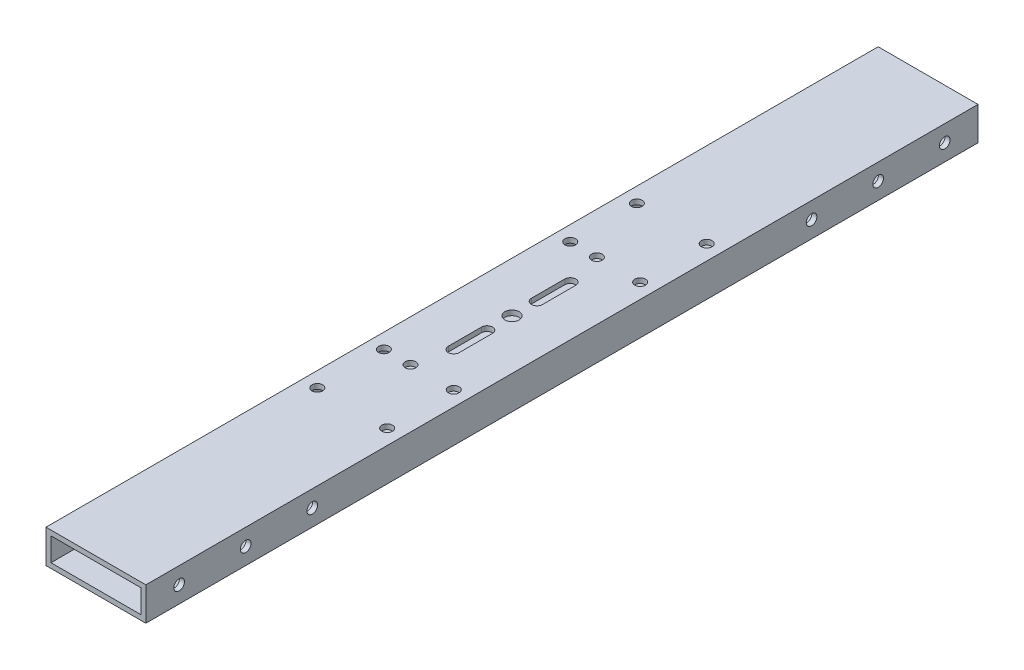
from build123d import *

# Parameters (mm, degrees)
SKETCH_1_W          = 30
SKETCH_1_H          = 10
SKETCH_1_W_2        = 27
SKETCH_1_H_2        = 7
EXTRUDE_1_DEPTH     = 250
SKETCH_2_R          = 1.6
CUT_EXTRUDE_1_DEPTH = 252.843205189
SKETCH_3_R          = 1.6
CUT_EXTRUDE_2_DEPTH = 251.64915719
SKETCH_4_R          = 2.15
CUT_EXTRUDE_3_DEPTH = 251.64915719


with BuildPart() as part:
    # 草图1 → 凸台-拉伸1 (new body)
    with BuildSketch(Plane.XY):
        Rectangle(SKETCH_1_W, SKETCH_1_H)
        Rectangle(SKETCH_1_W_2, SKETCH_1_H_2, mode=Mode.SUBTRACT)
    extrude(amount=EXTRUDE_1_DEPTH)

    # 草图2 → 切除-拉伸1 (cut, through all)
    with BuildSketch(Plane(origin=(15, 0, 0), x_dir=(0, 0, -1), z_dir=(1, 0, 0))):
        with Locations((-240, 0)):
            Circle(SKETCH_2_R)
        with Locations((-220, 0)):
            Circle(SKETCH_2_R)
        with Locations((-200, 0)):
            Circle(SKETCH_2_R)
        with Locations((-50, 0)):
            Circle(SKETCH_2_R)
        with Locations((-30, 0)):
            Circle(SKETCH_2_R)
        with Locations((-10, 0)):
            Circle(SKETCH_2_R)
    extrude(amount=-CUT_EXTRUDE_1_DEPTH, mode=Mode.SUBTRACT)

    # 草图3 → 切除-拉伸2 (cut, through all)
    with BuildSketch(Plane(origin=(0, 5, 0), x_dir=(1, 0, 0), z_dir=(0, 1, 0))):
        with Locations(Location((-2.5, -97, 0), (0, 0, 270))):
            Circle(SKETCH_3_R)
        with Locations(Location((10.5, -97, 0), (0, 0, 270))):
            Circle(SKETCH_3_R)
        with Locations(Location((-2.5, -153, 0), (0, 0, 270))):
            Circle(SKETCH_3_R)
        with Locations(Location((10.5, -153, 0), (0, 0, 270))):
            Circle(SKETCH_3_R)
        with Locations(Location((10.5, -173, 0), (0, 0, 270))):
            Circle(SKETCH_3_R)
        with Locations(Location((10.5, -77, 0), (0, 0, 270))):
            Circle(SKETCH_3_R)
        with Locations(Location((-10.5, -173, 0), (0, 0, 270))):
            Circle(SKETCH_3_R)
        with Locations(Location((-10.5, -153, 0), (0, 0, 270))):
            Circle(SKETCH_3_R)
        with Locations(Location((-10.5, -77, 0), (0, 0, 270))):
            Circle(SKETCH_3_R)
        with Locations(Location((-10.5, -97, 0), (0, 0, 270))):
            Circle(SKETCH_3_R)
    extrude(amount=-CUT_EXTRUDE_2_DEPTH, mode=Mode.SUBTRACT)

    # 草图4 → 切除-拉伸3 (cut, through all)
    with BuildSketch(Plane(origin=(0, 5, 0), x_dir=(1, 0, 0), z_dir=(0, 1, 0))):
        with Locations(Location((0, -125, 0), (0, 0, 270))):
            Circle(SKETCH_4_R)
        with BuildLine():
            Line((-1.65, -107.5), (-1.65, -117.5))
            ThreePointArc((-1.65, -117.5), (0, -119.15), (1.65, -117.5))
            Line((1.65, -117.5), (1.65, -107.5))
            ThreePointArc((1.65, -107.5), (0, -105.85), (-1.65, -107.5))
        make_face()
        with BuildLine():
            Line((1.65, -142.5), (1.65, -132.5))
            ThreePointArc((1.65, -132.5), (0, -130.85), (-1.65, -132.5))
            Line((-1.65, -132.5), (-1.65, -142.5))
            ThreePointArc((-1.65, -142.5), (0, -144.15), (1.65, -142.5))
        make_face()
    extrude(amount=-CUT_EXTRUDE_3_DEPTH, mode=Mode.SUBTRACT)


solid = part.part
